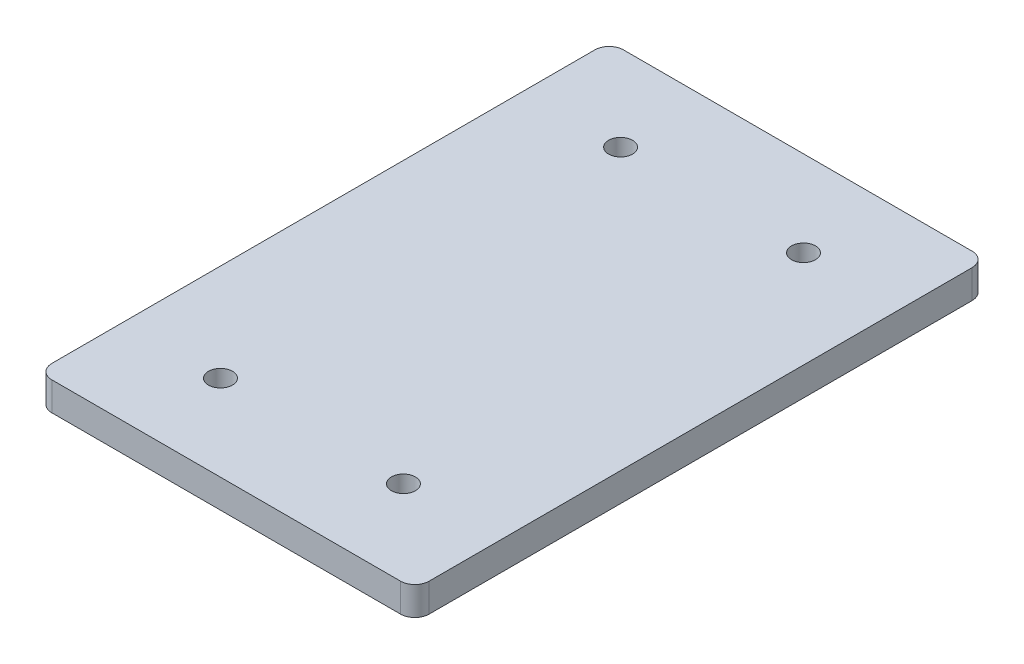
from build123d import *

# Parameters (mm, degrees)
SKETCH1_W                 = 66
SKETCH1_H                 = 100
BOSS_EXTRUDE1_DEPTH       = 5
F_4_0MM_DOWEL_HOLE1_D     = 4.2
F_4_0MM_DOWEL_HOLE1_DEPTH = 3
FILLET1_R                 = 2.5


with BuildPart() as part:
    # Sketch1 → Boss-Extrude1 (new body)
    with BuildSketch(Plane(origin=(0, 0, 0), x_dir=(1, 0, 0), z_dir=(0, 1, 0))):
        Rectangle(SKETCH1_W, SKETCH1_H)
    extrude(amount=BOSS_EXTRUDE1_DEPTH)

    # Ø4.0mm Dowel Hole1
    with Locations(Plane(origin=(0, 5, 0), x_dir=(1, 0, 0), z_dir=(0, 1, 0))):
        with Locations((-16, 35), (16, 35), (16, -35), (-16, -35)):
            Hole(F_4_0MM_DOWEL_HOLE1_D / 2, depth=F_4_0MM_DOWEL_HOLE1_DEPTH)

    # Fillet1
    fillet1_edges = [part.edges().sort_by_distance(p)[0] for p in [
        (-33, 2.5, -50),
        (33, 2.5, -50),
        (33, 2.5, 50),
        (-33, 2.5, 50),
    ]]
    fillet(fillet1_edges, radius=FILLET1_R)


solid = part.part
